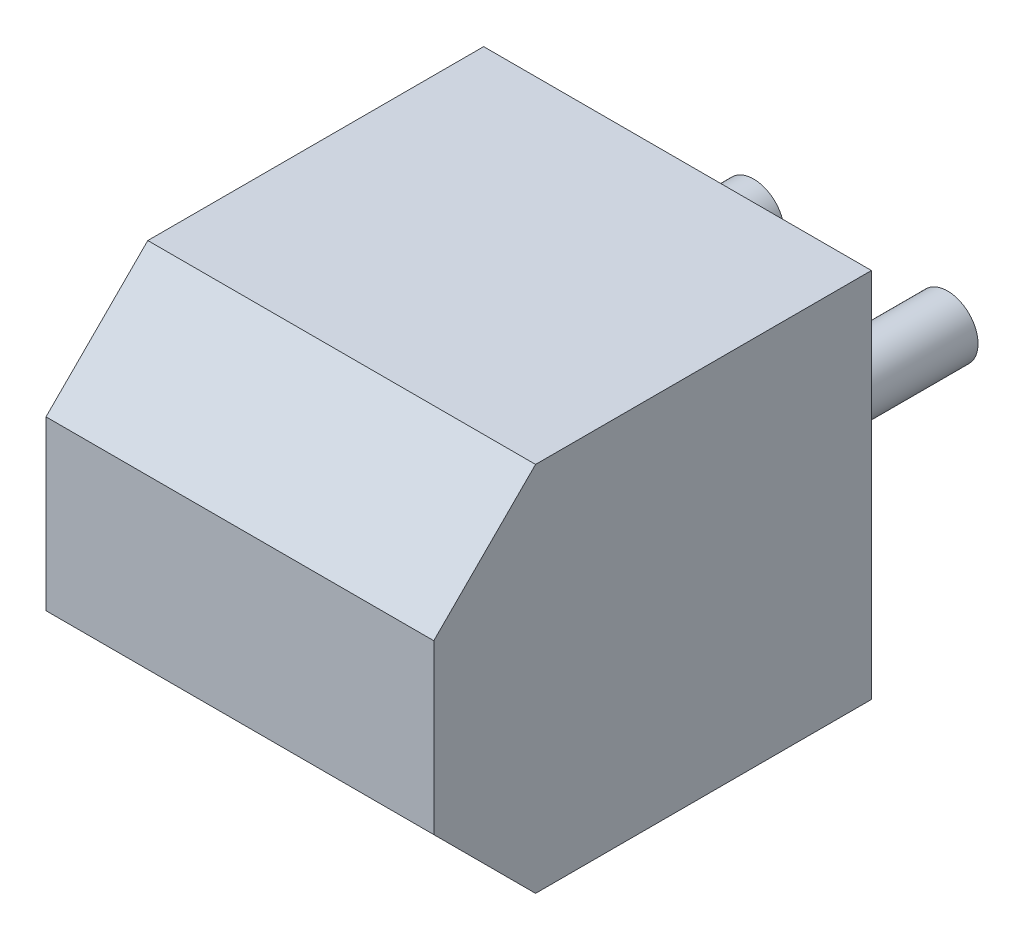
from build123d import *

# Parameters (mm, degrees)
SKETCH_1_W             = 7.62
SKETCH_1_H             = 7.3
EXTRUDE_1_DEPTH        = 8.6
CHAMFER_1_SIZE         = 2
SKETCH_2_W             = 1.5
SKETCH_2_H             = 2.244760595
CUT_EXTRUDE_1_DEPTH    = 0.5
PATTERN_LINEAR_1_COUNT = 2
PATTERN_LINEAR_1_PITCH = 3.81
SKETCH_3_R             = 0.6
EXTRUDE_2_DEPTH        = 3.4
PATTERN_LINEAR_2_COUNT = 2
PATTERN_LINEAR_2_PITCH = 3.81


with BuildPart() as part:
    # 草图1 → 凸台-拉伸1 (new body)
    with BuildSketch(Plane.XY):
        with Locations((3.81, 3.65)):
            Rectangle(SKETCH_1_W, SKETCH_1_H)
    extrude(amount=EXTRUDE_1_DEPTH)

    # 倒角1
    chamfer_1_edges = [part.edges().sort_by_distance(p)[0] for p in [
        (3.81, 7.3, 8.6),
        (3.81, 0, 8.6),
    ]]
    chamfer(chamfer_1_edges, length=CHAMFER_1_SIZE)

    # 草图2 → 切除-拉伸1 (cut)
    with BuildSketch(Plane.XZ):
        with Locations((1.905, 3.602057757)):
            Rectangle(SKETCH_2_W, SKETCH_2_H)
    cut_extrude_1 = extrude(amount=-CUT_EXTRUDE_1_DEPTH, mode=Mode.SUBTRACT)

    # 阵列(线性)1: 切除-拉伸1 ×2
    with Locations(*[(i * PATTERN_LINEAR_1_PITCH, 0, 0) for i in range(1, PATTERN_LINEAR_1_COUNT)]):
        add(cut_extrude_1, mode=Mode.SUBTRACT)

    # 草图3 → 凸台-拉伸2 (add)
    with BuildSketch(Plane(origin=(0, 0, 0), x_dir=(-1, 0, 0), z_dir=(0, 0, -1))):
        with Locations((-5.715, 3.7)):
            Circle(SKETCH_3_R)
    extrude_2 = extrude(amount=EXTRUDE_2_DEPTH)

    # 阵列(线性)2: 凸台-拉伸2 ×2
    with Locations(*[(-i * PATTERN_LINEAR_2_PITCH, 0, 0) for i in range(1, PATTERN_LINEAR_2_COUNT)]):
        add(extrude_2)


solid = part.part
